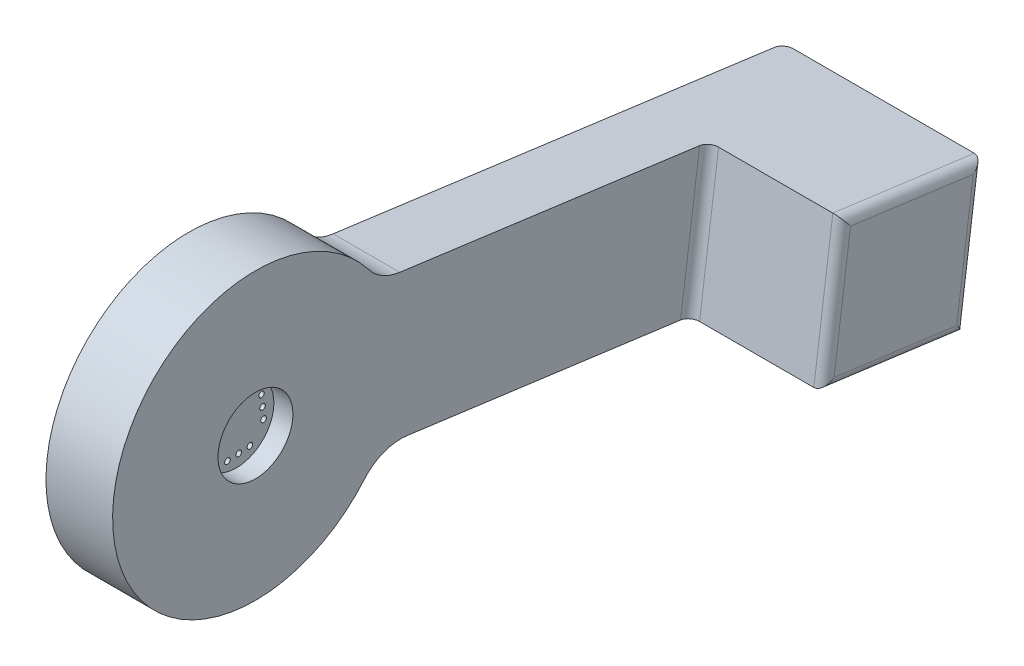
from build123d import *

# Parameters (mm, degrees)
BOSS_EXTRUDE1_DEPTH = 17.78
SKETCH2_R           = 10
CUT_EXTRUDE2_DEPTH  = 5.08
SKETCH8_R           = 0.75
SKETCH8_R_2         = 0.724827396
SKETCH8_R_3         = 0.742534986
CUT_EXTRUDE7_DEPTH  = 5.08
BOSS_EXTRUDE2_DEPTH = 35.56
SKETCH7_W           = 41.148
SKETCH7_H           = 20.066
CUT_EXTRUDE5_DEPTH  = 26.797
FILLET2_R           = 2.54
FILLET3_R           = 2.54
FILLET4_R           = 2.54
FILLET5_R           = 12.7


with BuildPart() as part:
    # Sketch1 → Boss-Extrude1 (new body)
    with BuildSketch(Plane(origin=(0, 0, 0), x_dir=(0, 0, -1), z_dir=(1, 0, 0))):
        with BuildLine():
            Line((32.896583501, -19.220426478), (153.708015153, -35.416630381))
            Line((153.708015153, -35.416630381), (158.7704814, 2.345538988))
            Line((158.7704814, 2.345538988), (32.896583501, 19.220426478))
            ThreePointArc((32.896583501, 19.220426478), (-38.1, 0), (32.896583501, -19.220426478))
        make_face()
    extrude(amount=BOSS_EXTRUDE1_DEPTH)

    # Sketch2 → Cut-Extrude2 (cut)
    with BuildSketch(Plane(origin=(17.78, 0, 0), x_dir=(0, 0, -1), z_dir=(1, 0, 0))):
        Circle(SKETCH2_R)
    extrude(amount=-CUT_EXTRUDE2_DEPTH, mode=Mode.SUBTRACT)

    # Sketch8 → Cut-Extrude7 (cut)
    with BuildSketch(Plane(origin=(12.7, 0, 0), x_dir=(0, 0, -1), z_dir=(1, 0, 0))):
        with Locations((-7.236662764, 2.372912145)):
            Circle(SKETCH8_R)
        with Locations((-6.97289018, -0.615469361)):
            Circle(SKETCH8_R)
        with Locations((-6.709117597, -3.603850867)):
            Circle(SKETCH8_R)
        with Locations((-2.372912145, -7.236662764)):
            Circle(SKETCH8_R)
        with Locations((0.615469361, -6.97289018)):
            Circle(SKETCH8_R)
        with Locations((3.603850867, -6.709117597)):
            Circle(SKETCH8_R)
        with Locations((7.236662764, -2.372912145)):
            Circle(SKETCH8_R)
        with Locations((6.97289018, 0.615469361)):
            Circle(SKETCH8_R)
        with Locations((6.709117597, 3.603850867)):
            Circle(SKETCH8_R_2)
        with Locations((2.372912145, 7.236662764)):
            Circle(SKETCH8_R)
        with Locations((-0.615469361, 6.97289018)):
            Circle(SKETCH8_R)
        with Locations((-3.603850867, 6.709117597)):
            Circle(SKETCH8_R_3)
    extrude(amount=-CUT_EXTRUDE7_DEPTH, mode=Mode.SUBTRACT)

    # Sketch4 → Boss-Extrude2 (add)
    with BuildSketch(Plane(origin=(17.78, 0, 0), x_dir=(0, 0, -1), z_dir=(1, 0, 0))):
        Polygon((158.7704814, 2.345538988), (153.708015153, -35.416630381), (115.945845783, -30.354164135), (121.00831203, 7.408005235), align=None)
    extrude(amount=BOSS_EXTRUDE2_DEPTH)

    # Sketch7 → Cut-Extrude5 (cut)
    with BuildSketch(Plane(origin=(0, -20.867859649, -155.658450257), x_dir=(-1, 0, 0), z_dir=(0, -0.1328731298372059, -0.9911330543207936))):
        with Locations((-26.769839531, 4.371072011)):
            Rectangle(SKETCH7_W, SKETCH7_H)
    extrude(amount=-CUT_EXTRUDE5_DEPTH, mode=Mode.SUBTRACT)

    # Fillet2
    fillet2_edges = [part.edges().sort_by_distance(p)[0] for p in [
        (17.78, -11.47307945, -118.477078906),
    ]]
    fillet(fillet2_edges, radius=FILLET2_R)

    # Fillet3
    fillet3_edges = [part.edges().sort_by_distance(p)[0] for p in [
        (53.34, 4.876772112, -139.889396715),
        (53.34, -11.47307945, -118.477078906),
        (53.34, -32.885397258, -134.826930468),
        (53.34, -16.535545697, -156.239248276),
    ]]
    fillet(fillet3_edges, radius=FILLET3_R)

    # Fillet4
    fillet4_edges = [part.edges().sort_by_distance(p)[0] for p in [
        (0, -16.535545697, -156.239248276),
    ]]
    fillet(fillet4_edges, radius=FILLET4_R)

    # Fillet5
    fillet5_edges = [part.edges().sort_by_distance(p)[0] for p in [
        (8.89, -19.220426478, -32.896583501),
        (8.89, 19.220426478, -32.896583501),
    ]]
    fillet(fillet5_edges, radius=FILLET5_R)


solid = part.part
